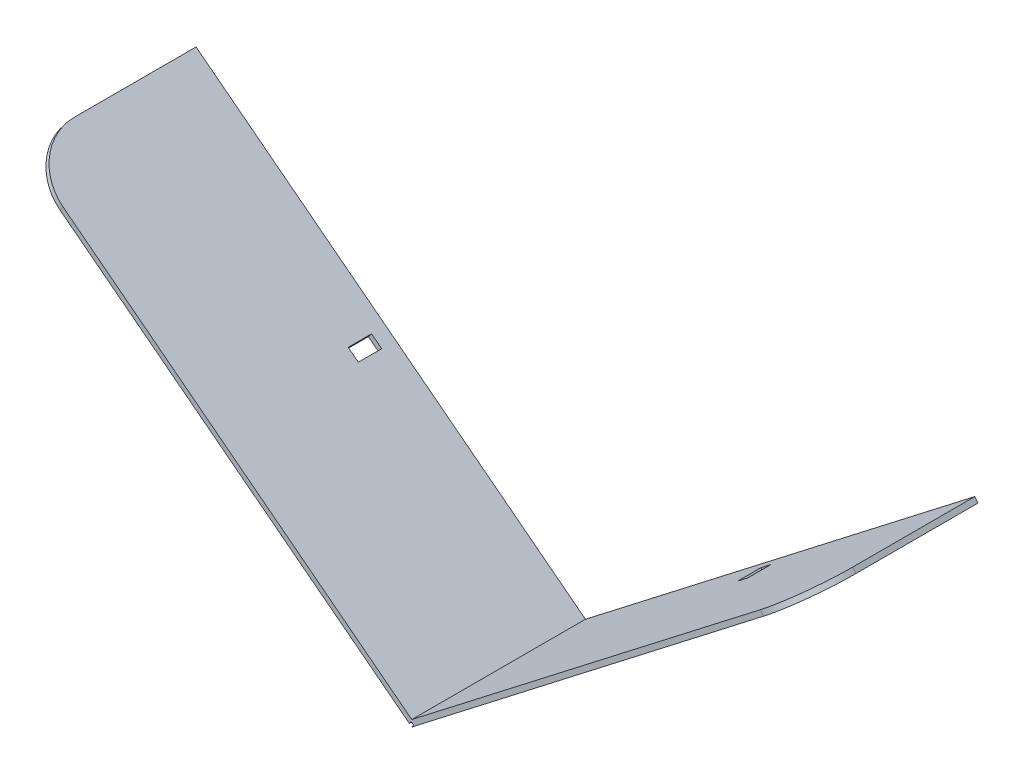
from build123d import *

# Parameters (mm, degrees)
BOSS_EXTRUDE1_DEPTH     = 240.2
CUT_EXTRUDE3_DEPTH      = 540.188032545
CUT_EXTRUDE3_DEPTH_BACK = 540.188032545
SKETCH2_W               = 760.049325768
SKETCH2_H               = 72.06
SKETCH3_W               = 12.4
SKETCH3_H               = 22.6
CUT_EXTRUDE4_DEPTH      = 512.167734023
FILLET1_R               = 50
SKETCH5_W               = 3
SKETCH5_H               = 33.628
CUT_EXTRUDE6_DEPTH      = 3


with BuildPart() as part:
    # Sketch1 → Boss-Extrude1 (new body)
    with BuildSketch(Plane.XY):
        Polygon((0, 0), (380.024662884, 293.716437401), (376.967027683, 297.672555066), (0, 6.319326703), (-376.967027683, 297.672555066), (-380.024662884, 293.716437401), align=None)
    extrude(amount=-BOSS_EXTRUDE1_DEPTH)

    # Sketch2 → Cut-Extrude3 (cut, two sides: drawn at the far end of the back side and taken through both)
    with BuildSketch(Plane(origin=(0, 0, 0), x_dir=(1, 0, 0), z_dir=(0, 1, 0)).offset(-CUT_EXTRUDE3_DEPTH_BACK)):
        with Locations((0, 204.17)):
            Rectangle(SKETCH2_W, SKETCH2_H)
    extrude(amount=CUT_EXTRUDE3_DEPTH + CUT_EXTRUDE3_DEPTH_BACK, mode=Mode.SUBTRACT)

    # Sketch3 → Cut-Extrude4 (cut, symmetric)
    with BuildSketch(Plane(origin=(3.057635201, 3.956117665, 0), x_dir=(0.7912235329674936, -0.6115270401858268, 0), z_dir=(0.6115270401858268, 0.7912235329674936, 0))):
        with Locations((-242.082219577, 143.14)):
            Rectangle(SKETCH3_W, SKETCH3_H)
    cut_extrude4 = extrude(amount=CUT_EXTRUDE4_DEPTH, both=True, mode=Mode.SUBTRACT)

    # Mirror1: Cut-Extrude4 across plane
    add(cut_extrude4.mirror(Plane(origin=(0, 0, 0), x_dir=(0, 0, 1), z_dir=(1, 0, 0))), mode=Mode.SUBTRACT)

    # Fillet1
    fillet1_edges = [part.edges().sort_by_distance(p)[0] for p in [
        (-378.495845284, 295.694496234, 0),
        (378.495845284, 295.694496234, 0),
    ]]
    fillet(fillet1_edges, radius=FILLET1_R)

    # Sketch5 → Cut-Extrude6 (cut)
    with BuildSketch(Plane(origin=(0, 0, 0), x_dir=(0.7912235329674936, -0.6115270401858267, 0), z_dir=(-0.6115270401858267, -0.7912235329674936, 0))):
        with Locations((-1.5, -16.814)):
            Rectangle(SKETCH5_W, SKETCH5_H)
        with Locations((-1.5, -84.07)):
            Rectangle(SKETCH5_W, SKETCH5_H)
        with Locations((-1.5, -151.326)):
            Rectangle(SKETCH5_W, SKETCH5_H)
    extrude(amount=-CUT_EXTRUDE6_DEPTH, mode=Mode.SUBTRACT)


solid = part.part
